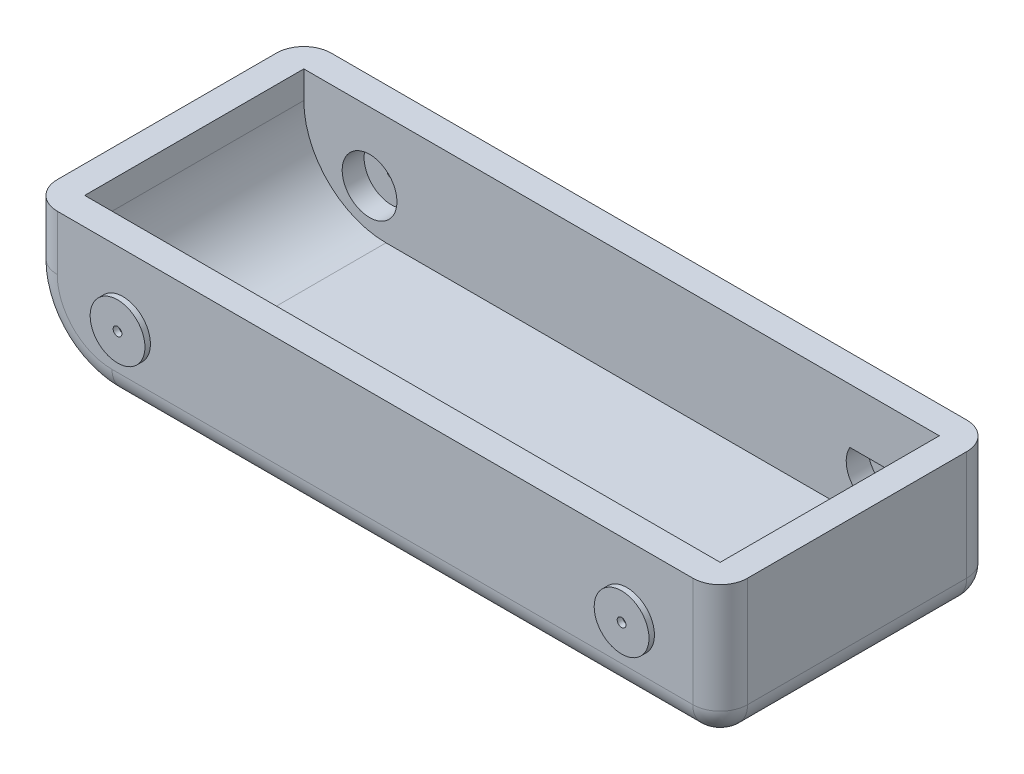
from build123d import *

# Parameters (mm, degrees)
SKETCH1_W           = 126
SKETCH1_H           = 50
BOSS_EXTRUDE1_DEPTH = 25
SKETCH3_W           = 116
SKETCH3_H           = 40
CUT_EXTRUDE1_DEPTH  = 20
FILLET1_R           = 15
FILLET2_R           = 15
CUT_EXTRUDE2_START  = -5
SKETCH4_R           = 5
CUT_EXTRUDE2_DEPTH  = 4
SKETCH9_R           = 5
BOSS_EXTRUDE5_DEPTH = 1
SKETCH11_R          = 0.8
CUT_EXTRUDE5_DEPTH  = 5
FILLET3_R           = 5
FILLET4_R           = 5
BOSS_EXTRUDE6_START = 1
SKETCH12_R          = 5
BOSS_EXTRUDE6_DEPTH = 1
CUT_EXTRUDE8_START  = -5
SKETCH13_R          = 5
CUT_EXTRUDE8_DEPTH  = 5
SKETCH14_R          = 0.8
CUT_EXTRUDE9_DEPTH  = 5


with BuildPart() as part:
    # Sketch1 → Boss-Extrude1 (new body)
    with BuildSketch(Plane(origin=(0, 0, 0), x_dir=(1, 0, 0), z_dir=(0, 1, 0))):
        with Locations((63, 25)):
            Rectangle(SKETCH1_W, SKETCH1_H)
    extrude(amount=BOSS_EXTRUDE1_DEPTH)

    # Sketch3 → Cut-Extrude1 (cut)
    with BuildSketch(Plane(origin=(0, 25, 0), x_dir=(1, 0, 0), z_dir=(0, 1, 0))):
        with Locations((63, 25)):
            Rectangle(SKETCH3_W, SKETCH3_H)
    extrude(amount=-CUT_EXTRUDE1_DEPTH, mode=Mode.SUBTRACT)

    # Fillet1
    fillet1_edges = [part.edges().sort_by_distance(p)[0] for p in [
        (0, 0, -25),
    ]]
    fillet(fillet1_edges, radius=FILLET1_R)

    # Fillet2
    fillet2_edges = [part.edges().sort_by_distance(p)[0] for p in [
        (5, 5, -25),
    ]]
    fillet(fillet2_edges, radius=FILLET2_R)

    # Sketch4 → Cut-Extrude2 (cut)
    with BuildSketch(Plane(origin=(0, 0, -50), x_dir=(-1, 0, 0), z_dir=(0, 0, -1)).offset(CUT_EXTRUDE2_START)):
        with BuildLine():
            Line((-104.669872981, 15), (-113.330127019, 15))
            ThreePointArc((-113.330127019, 15), (-109, 7.5), (-104.669872981, 15))
        make_face()
        with Locations((-17, 12.5)):
            Circle(SKETCH4_R)
    extrude(amount=CUT_EXTRUDE2_DEPTH, mode=Mode.SUBTRACT)

    # Sketch9 → Boss-Extrude5 (add)
    with BuildSketch(Plane(origin=(0, 0, -50), x_dir=(-1, 0, 0), z_dir=(0, 0, -1))):
        with Locations(Location((-109, 12.5, 0), (0, 0, 180))):
            Circle(SKETCH9_R)
        with Locations((-17, 12.5)):
            Circle(SKETCH9_R)
    extrude(amount=BOSS_EXTRUDE5_DEPTH)

    # Sketch11 → Cut-Extrude5 (cut)
    with BuildSketch(Plane(origin=(0, 0, -51), x_dir=(-1, 0, 0), z_dir=(0, 0, -1))):
        with Locations((-17, 12.5)):
            Circle(SKETCH11_R)
        with Locations((-109, 12.5)):
            Circle(SKETCH11_R)
    extrude(amount=-CUT_EXTRUDE5_DEPTH, mode=Mode.SUBTRACT)

    # Fillet3
    fillet3_edges = [part.edges().sort_by_distance(p)[0] for p in [
        (126, 12.5, -50),
        (126, 12.5, 0),
    ]]
    fillet(fillet3_edges, radius=FILLET3_R)

    # Fillet4
    fillet4_edges = [part.edges().sort_by_distance(p)[0] for p in [
        (68, 0, 0),
        (4.393398282, 4.393398282, 0),
        (4.393398282, 4.393398282, -50),
        (68, 0, -50),
        (126, 0, -25),
        (124.535533906, 0, -1.464466094),
        (124.535533906, 0, -48.535533906),
        (0, 20, -50),
        (0, 20, 0),
    ]]
    fillet(fillet4_edges, radius=FILLET4_R)

    # Sketch12 → Boss-Extrude6 (add)
    with BuildSketch(Plane.XY.offset(BOSS_EXTRUDE6_START)):
        with Locations(Location((17, 12.5, 0), (0, 0, 180))):
            Circle(SKETCH12_R)
        with Locations((109, 12.5)):
            Circle(SKETCH12_R)
    extrude(amount=-BOSS_EXTRUDE6_DEPTH)

    # Sketch13 → Cut-Extrude8 (cut)
    with BuildSketch(Plane(origin=(0, 0, -5), x_dir=(-1, 0, 0), z_dir=(0, 0, -1)).offset(CUT_EXTRUDE8_START)):
        with Locations(Location((-109, 12.5, 0), (0, 0, 180))):
            Circle(SKETCH13_R)
        with Locations((-17, 12.5)):
            Circle(SKETCH13_R)
    extrude(amount=CUT_EXTRUDE8_DEPTH, mode=Mode.SUBTRACT)


with BuildPart() as cut_extrude8_piece_1:
    # of the separate pieces the step leaves, piece 1, a body of its own (cut_extrude8_pieces)
    add(part.part.solids().sort_by_distance((5, 25, 0))[0])


with BuildPart() as cut_extrude8_piece_2:
    # of the separate pieces the step leaves, piece 2, a body of its own (cut_extrude8_pieces)
    add(part.part.solids().sort_by_distance((12, 12.5, 1))[0])


with BuildPart() as cut_extrude8_piece_3:
    # of the separate pieces the step leaves, piece 3, a body of its own (cut_extrude8_pieces)
    add(part.part.solids().sort_by_distance((114, 12.5, 1))[0])


with BuildPart() as cut_extrude9_tool:
    # Sketch14 → Cut-Extrude9 (new body)
    with BuildSketch(Plane.XY):
        with Locations(Location((17, 12.5, 0), (0, 0, 180))):
            Circle(SKETCH14_R)
        with Locations(Location((109, 12.5, 0), (0, 0, 180))):
            Circle(SKETCH14_R)
    extrude(amount=CUT_EXTRUDE9_DEPTH)


with BuildPart() as cut_extrude8_piece_2_1:
    add(cut_extrude8_piece_2.part)

    # Cut-Extrude9: cut by cut_extrude9_tool
    add(cut_extrude9_tool.part, mode=Mode.SUBTRACT)


with BuildPart() as cut_extrude8_piece_3_1:
    add(cut_extrude8_piece_3.part)

    # Cut-Extrude9: cut by cut_extrude9_tool
    add(cut_extrude9_tool.part, mode=Mode.SUBTRACT)


solid = Compound([cut_extrude8_piece_1.part, cut_extrude8_piece_2_1.part, cut_extrude8_piece_3_1.part])
